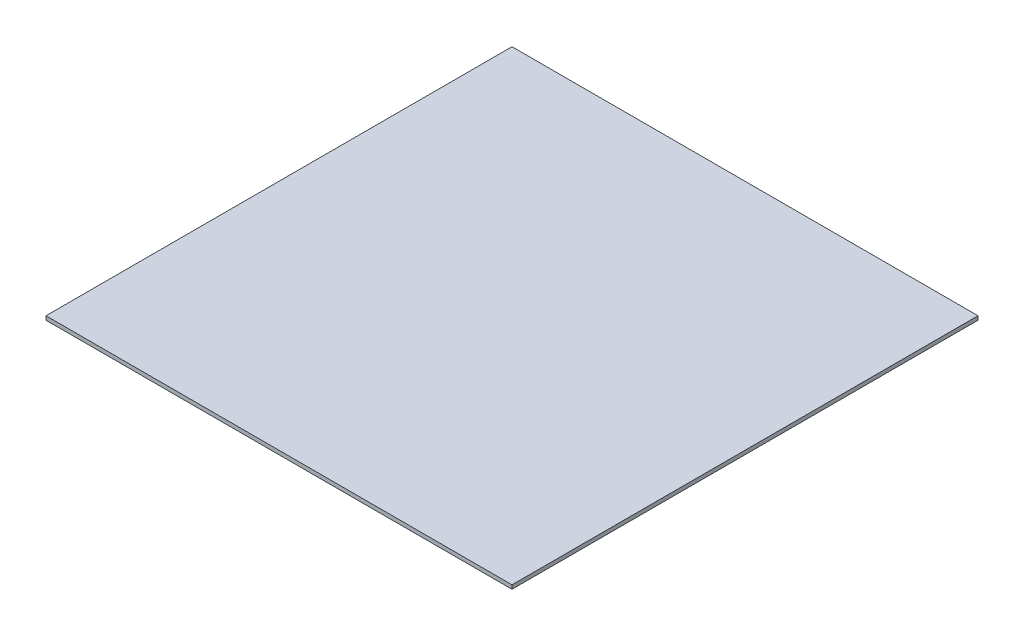
from build123d import *

# Parameters (mm, degrees)
SKETCH1_W           = 240
SKETCH1_H           = 240
BOSS_EXTRUDE1_DEPTH = 1


with BuildPart() as part:
    # Sketch1 → Boss-Extrude1 (new, symmetric)
    with BuildSketch(Plane(origin=(0, 0, 0), x_dir=(1, 0, 0), z_dir=(0, 1, 0))):
        Rectangle(SKETCH1_W, SKETCH1_H)
    extrude(amount=BOSS_EXTRUDE1_DEPTH, both=True)


solid = part.part
